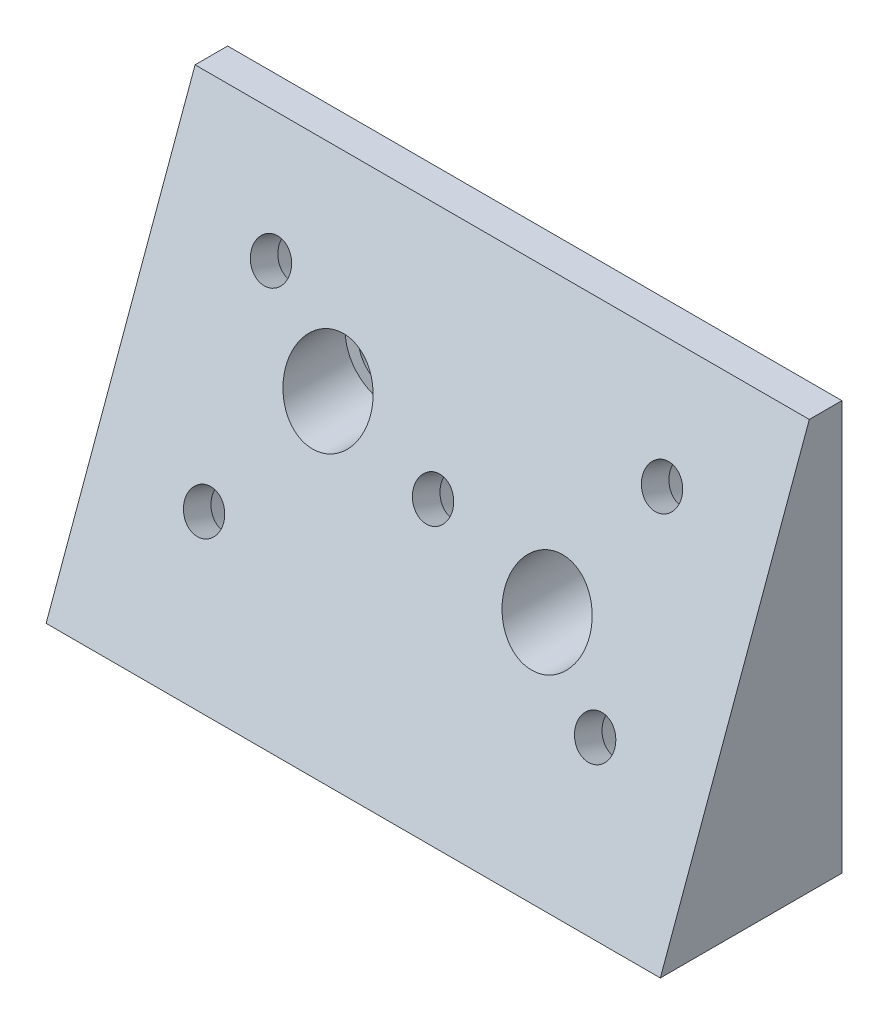
from build123d import *

# Parameters (mm, degrees)
BOSS_EXTRUDE1_DEPTH = 94.24
SKETCH2_R           = 4.5
CUT_EXTRUDE1_DEPTH  = 94.24
CUT_EXTRUDE2_START  = -4.69
SKETCH2_3_R         = 6.5
CUT_EXTRUDE2_DEPTH  = 94.24
SKETCH3_R           = 3
CUT_EXTRUDE3_DEPTH  = 94.24
CUT_EXTRUDE4_START  = -4.5
SKETCH3_3_R         = 4.75
CUT_EXTRUDE4_DEPTH  = 94.24


with BuildPart() as part:
    # Sketch1 → Boss-Extrude1 (new body)
    with BuildSketch(Plane(origin=(0, 0, 0), x_dir=(0, 0, -1), z_dir=(1, 0, 0))):
        Polygon((0, 0), (0, 62.78974436), (-5, 62.78974436), (-27.85359797, 0), align=None)
    extrude(amount=-BOSS_EXTRUDE1_DEPTH)

    # Sketch2 → Cut-Extrude1 (cut)
    with BuildSketch(Plane(origin=(0, 0, 0), x_dir=(-1, 0, 0), z_dir=(0, 0, -1))):
        with Locations((28.02184799, 29.25081122)):
            Circle(SKETCH2_R)
        with Locations((64.99011516, 38.46803544)):
            Circle(SKETCH2_R)
    extrude(amount=-CUT_EXTRUDE1_DEPTH, mode=Mode.SUBTRACT)

    # Sketch2<3> → Cut-Extrude2 (cut)
    with BuildSketch(Plane(origin=(0, 0, 0), x_dir=(-1, 0, 0), z_dir=(0, 0, -1)).offset(CUT_EXTRUDE2_START)):
        with Locations((28.02184799, 29.25081122)):
            Circle(SKETCH2_3_R)
        with Locations((64.99011516, 38.46803544)):
            Circle(SKETCH2_3_R)
    extrude(amount=-CUT_EXTRUDE2_DEPTH, mode=Mode.SUBTRACT)

    # Sketch3 → Cut-Extrude3 (cut)
    with BuildSketch(Plane(origin=(0, 8.951973832, 24.595345956), x_dir=(1, 0, 0), z_dir=(0, 0.3420201434019967, 0.9396926207581273))):
        with Locations((-17.20092637, 11.517541778)):
            Circle(SKETCH3_R)
        with Locations((-17.20092637, 41.517541778)):
            Circle(SKETCH3_R)
        with Locations((-47.20092637, 26.517541778)):
            Circle(SKETCH3_R)
        with Locations((-77.20092637, 41.517541778)):
            Circle(SKETCH3_R)
        with Locations((-77.20092637, 11.517541778)):
            Circle(SKETCH3_R)
    extrude(amount=-CUT_EXTRUDE3_DEPTH, mode=Mode.SUBTRACT)

    # Sketch3<3> → Cut-Extrude4 (cut)
    with BuildSketch(Plane(origin=(0, 8.951973832, 24.595345956), x_dir=(1, 0, 0), z_dir=(0, 0.3420201434019967, 0.9396926207581273)).offset(CUT_EXTRUDE4_START)):
        with Locations((-17.20092637, 11.517541778)):
            Circle(SKETCH3_3_R)
        with Locations((-17.20092637, 41.517541778)):
            Circle(SKETCH3_3_R)
        with Locations((-47.20092637, 26.517541778)):
            Circle(SKETCH3_3_R)
        with Locations((-77.20092637, 11.517541778)):
            Circle(SKETCH3_3_R)
        with Locations((-77.20092637, 41.517541778)):
            Circle(SKETCH3_3_R)
    extrude(amount=-CUT_EXTRUDE4_DEPTH, mode=Mode.SUBTRACT)


solid = part.part
